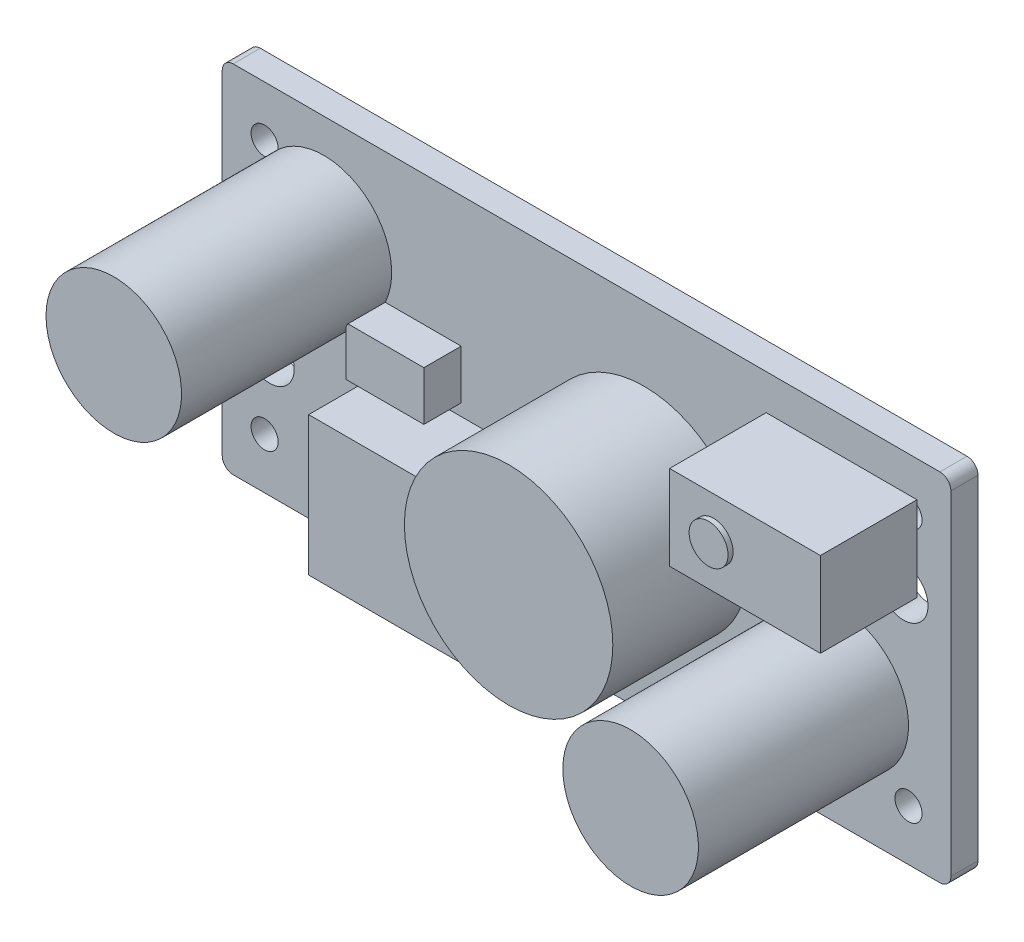
from build123d import *

# Parameters (mm, degrees)
PCB_43X21X1P6_SKETCH_R     = 0.8
PCB_43X21X1P6_SKETCH_R_2   = 1.45
PCB_43X21X1P6_DEPTH        = 1.6
LM2596S_TO263_START        = 1.6
LM2596S_TO263_SKETCH_W     = 9
LM2596S_TO263_SKETCH_H     = 8.2
LM2596S_TO263_DEPTH        = 4.4
TRIM_POT_START             = 1.6
TRIM_POT_SKETCH_W          = 8.9
TRIM_POT_SKETCH_H          = 5
TRIM_POT_DEPTH             = 5.7
TRIM_ADJUST_START          = 7.3
TRIM_ADJUST_SKETCH_R       = 1.15
TRIM_ADJUST_DEPTH          = 0.3
SHIELDED_INDUCTOR_START    = 1.6
SHIELDED_INDUCTOR_SKETCH_R = 6.15
SHIELDED_INDUCTOR_DEPTH    = 8
INPUT_CAPACITOR_START      = 1.6
INPUT_CAPACITOR_SKETCH_R   = 4
INPUT_CAPACITOR_DEPTH      = 12.4
OUTPUT_CAPACITOR_START     = 1.6
OUTPUT_CAPACITOR_SKETCH_R  = 4
OUTPUT_CAPACITOR_DEPTH     = 12.4
SCHOTTKY_DIODE_START       = 1.6
SCHOTTKY_DIODE_SKETCH_W    = 4.6
SCHOTTKY_DIODE_SKETCH_H    = 2.9
SCHOTTKY_DIODE_DEPTH       = 2.2


with BuildPart() as part:
    # PCB_43x21x1p6_Sketch → PCB_43x21x1p6 (new body)
    with BuildSketch(Plane.XY):
        with BuildLine():
            Line((-20.85, -10.5), (20.85, -10.5))
            ThreePointArc((20.85, -10.5), (21.309619408, -10.309619408), (21.5, -9.85))
            Line((21.5, -9.85), (21.5, 9.85))
            ThreePointArc((21.5, 9.85), (21.309619408, 10.309619408), (20.85, 10.5))
            Line((20.85, 10.5), (-20.85, 10.5))
            ThreePointArc((-20.85, 10.5), (-21.309619408, 10.309619408), (-21.5, 9.85))
            Line((-21.5, 9.85), (-21.5, -9.85))
            ThreePointArc((-21.5, -9.85), (-21.309619408, -10.309619408), (-20.85, -10.5))
        make_face()
        with Locations((-19, -7.5)):
            Circle(PCB_43X21X1P6_SKETCH_R, mode=Mode.SUBTRACT)
        with Locations((-19, 7.5)):
            Circle(PCB_43X21X1P6_SKETCH_R, mode=Mode.SUBTRACT)
        with Locations((19, -7.5)):
            Circle(PCB_43X21X1P6_SKETCH_R, mode=Mode.SUBTRACT)
        with Locations((19, 7.5)):
            Circle(PCB_43X21X1P6_SKETCH_R, mode=Mode.SUBTRACT)
        with Locations((-18.7, -3.3)):
            Circle(PCB_43X21X1P6_SKETCH_R_2, mode=Mode.SUBTRACT)
        with Locations((18.7, 3.3)):
            Circle(PCB_43X21X1P6_SKETCH_R_2, mode=Mode.SUBTRACT)
    extrude(amount=PCB_43X21X1P6_DEPTH)


with BuildPart() as body_2:
    # LM2596S_TO263_Sketch → LM2596S_TO263 (new body)
    with BuildSketch(Plane.XY.offset(LM2596S_TO263_START)):
        with Locations((-7.5, -4.9)):
            Rectangle(LM2596S_TO263_SKETCH_W, LM2596S_TO263_SKETCH_H)
    extrude(amount=LM2596S_TO263_DEPTH)


with BuildPart() as body_3:
    # Trim_pot_Sketch → Trim_pot (new body)
    with BuildSketch(Plane.XY.offset(TRIM_POT_START)):
        with Locations((15.05, 5.9)):
            Rectangle(TRIM_POT_SKETCH_W, TRIM_POT_SKETCH_H)
    extrude(amount=TRIM_POT_DEPTH)


with BuildPart() as body_4:
    # Trim_Adjust_Sketch → Trim_Adjust (new body)
    with BuildSketch(Plane.XY.offset(TRIM_ADJUST_START)):
        with Locations((13.2, 6)):
            Circle(TRIM_ADJUST_SKETCH_R)
    extrude(amount=TRIM_ADJUST_DEPTH)


with BuildPart() as body_5:
    # Shielded_inductor_Sketch → Shielded_inductor (new body)
    with BuildSketch(Plane.XY.offset(SHIELDED_INDUCTOR_START)):
        with Locations((3.4, 0)):
            Circle(SHIELDED_INDUCTOR_SKETCH_R)
    extrude(amount=SHIELDED_INDUCTOR_DEPTH)


with BuildPart() as body_6:
    # Input_capacitor_Sketch → Input_capacitor (new body)
    with BuildSketch(Plane.XY.offset(INPUT_CAPACITOR_START)):
        with Locations(Location((-15.5, 4.5, 0), (0, 0, 180))):
            Circle(INPUT_CAPACITOR_SKETCH_R)
    extrude(amount=INPUT_CAPACITOR_DEPTH)


with BuildPart() as body_7:
    # Output_capacitor_Sketch → Output_capacitor (new body)
    with BuildSketch(Plane.XY.offset(OUTPUT_CAPACITOR_START)):
        with Locations(Location((15, -3.4, 0), (0, 0, 180))):
            Circle(OUTPUT_CAPACITOR_SKETCH_R)
    extrude(amount=OUTPUT_CAPACITOR_DEPTH)


with BuildPart() as body_8:
    # Schottky_diode_Sketch → Schottky_diode (new body)
    with BuildSketch(Plane.XY.offset(SCHOTTKY_DIODE_START)):
        with Locations((-9.7, 1.35)):
            Rectangle(SCHOTTKY_DIODE_SKETCH_W, SCHOTTKY_DIODE_SKETCH_H)
    extrude(amount=SCHOTTKY_DIODE_DEPTH)


solid = Compound([part.part, body_2.part, body_3.part, body_4.part, body_5.part, body_6.part, body_7.part, body_8.part])
